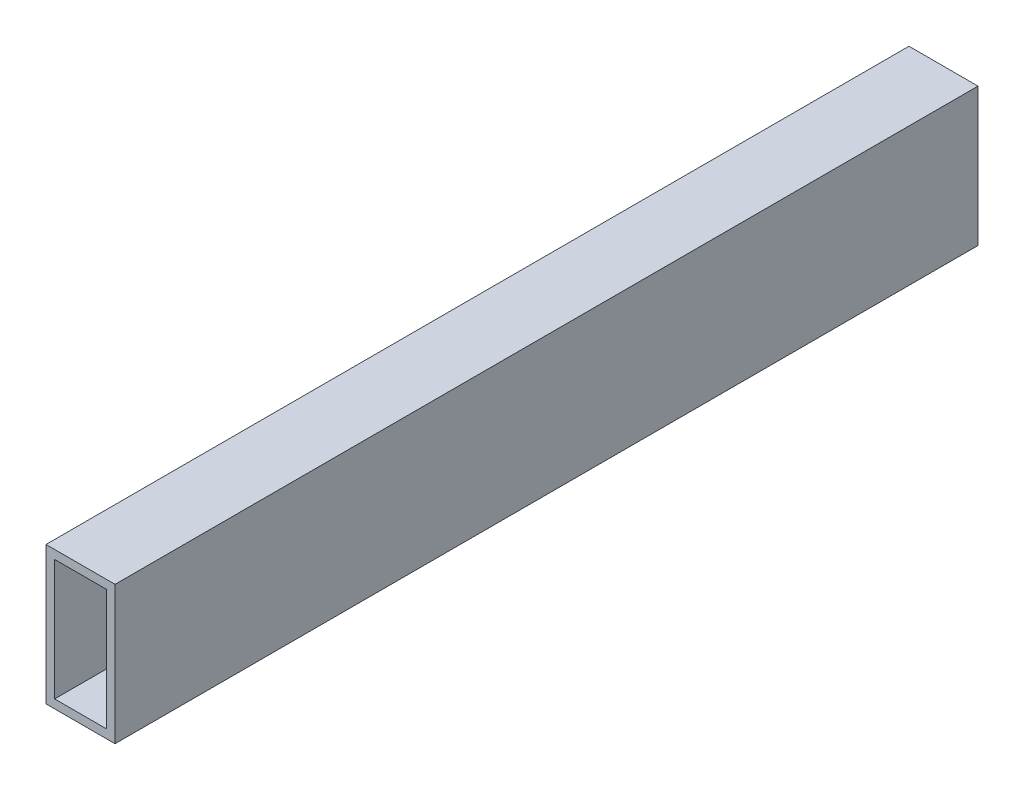
from build123d import *

# Parameters (mm, degrees)
SKETCH1_W           = 25.4
SKETCH1_H           = 50.8
SKETCH1_W_2         = 19.05
SKETCH1_H_2         = 44.45
BOSS_EXTRUDE1_DEPTH = 158.75


with BuildPart() as part:
    # Sketch1 → Boss-Extrude1 (new, symmetric)
    with BuildSketch(Plane.XY):
        Rectangle(SKETCH1_W, SKETCH1_H)
        Rectangle(SKETCH1_W_2, SKETCH1_H_2, mode=Mode.SUBTRACT)
    extrude(amount=BOSS_EXTRUDE1_DEPTH, both=True)


solid = part.part
